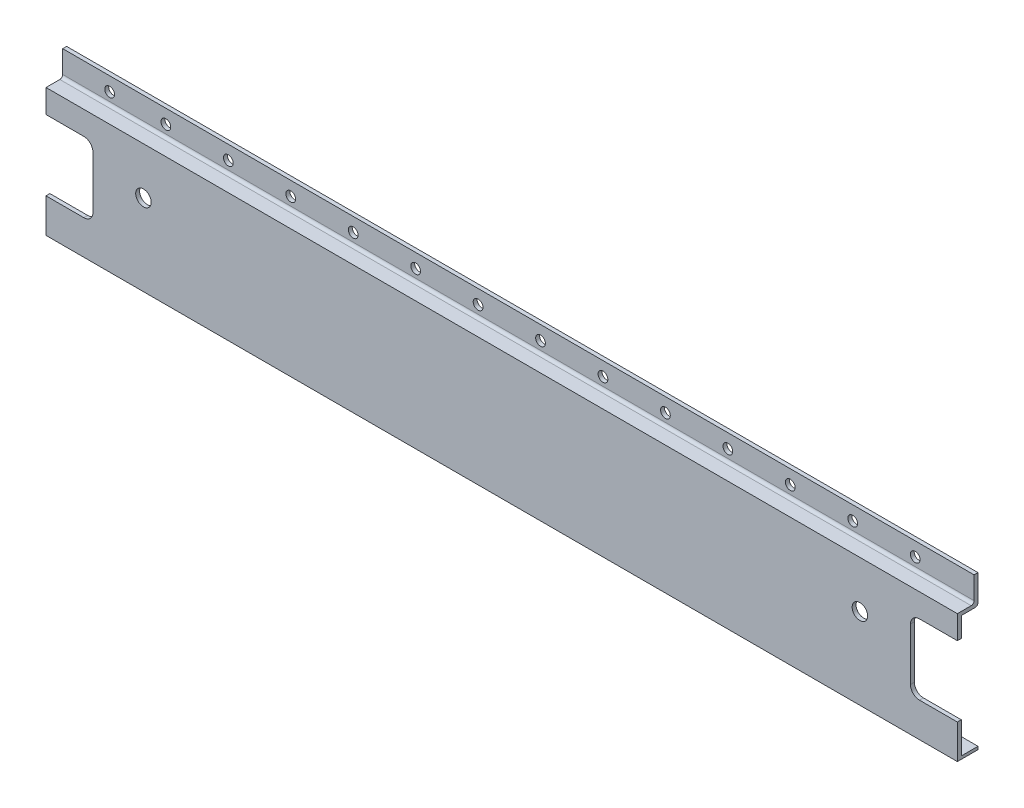
from build123d import *

# Parameters (mm, degrees)
SKETCH1_W           = 641.35
SKETCH1_H           = 107.95
BOSS_EXTRUDE1_DEPTH = 14.5161
SKETCH2_W           = 641.35
SKETCH2_H           = 17.78
CUT_EXTRUDE1_DEPTH  = 11.7602
SKETCH3_W           = 641.35
SKETCH3_H           = 85.5345
CUT_EXTRUDE3_DEPTH  = 11.7602
FILLET1_R           = 2.032
CUT_EXTRUDE4_DEPTH  = 326.398307546
SKETCH5_R           = 3.429
CUT_EXTRUDE5_DEPTH  = 11.7602
SKETCH6_R           = 5.461
CUT_EXTRUDE6_DEPTH  = 11.7602
SKETCH7_R           = 2.54
CUT_EXTRUDE7_DEPTH  = 2.54


with BuildPart() as part:
    # Sketch1 → Boss-Extrude1 (new body)
    with BuildSketch(Plane.XY):
        Rectangle(SKETCH1_W, SKETCH1_H)
    extrude(amount=BOSS_EXTRUDE1_DEPTH)

    # Sketch2 → Cut-Extrude1 (cut)
    with BuildSketch(Plane.XY.offset(14.5161)):
        with Locations((0, 45.085)):
            Rectangle(SKETCH2_W, SKETCH2_H)
    extrude(amount=-CUT_EXTRUDE1_DEPTH, mode=Mode.SUBTRACT)

    # Sketch3 → Cut-Extrude3 (cut)
    with BuildSketch(Plane(origin=(0, 0, 0), x_dir=(-1, 0, 0), z_dir=(0, 0, -1))):
        with Locations((0, -9.11225)):
            Rectangle(SKETCH3_W, SKETCH3_H)
    extrude(amount=-CUT_EXTRUDE3_DEPTH, mode=Mode.SUBTRACT)

    # Fillet1
    fillet1_edges = [part.edges().sort_by_distance(p)[0] for p in [
        (0, 36.195, 2.7559),
        (0, 33.655, 0),
    ]]
    fillet(fillet1_edges, radius=FILLET1_R)

    # Sketch4 → Cut-Extrude4 (cut, through all)
    with BuildSketch(Plane(origin=(0, 0, 11.7602), x_dir=(-1, 0, 0), z_dir=(0, 0, -1))):
        with BuildLine():
            Line((-294.005, 19.685), (-320.675, 19.685))
            Line((-320.675, 19.685), (-320.675, -29.845))
            Line((-320.675, -29.845), (-294.005, -29.845))
            ThreePointArc((-294.005, -29.845), (-289.514871939, -27.985128061), (-287.655, -23.495))
            Line((-287.655, -23.495), (-287.655, 13.335))
            ThreePointArc((-287.655, 13.335), (-289.514871939, 17.825128061), (-294.005, 19.685))
        make_face()
        with BuildLine():
            Line((294.005, -29.845), (320.675, -29.845))
            Line((320.675, -29.845), (320.675, 19.685))
            Line((320.675, 19.685), (294.005, 19.685))
            ThreePointArc((294.005, 19.685), (289.514871939, 17.825128061), (287.655, 13.335))
            Line((287.655, 13.335), (287.655, -23.495))
            ThreePointArc((287.655, -23.495), (289.514871939, -27.985128061), (294.005, -29.845))
        make_face()
    extrude(amount=-CUT_EXTRUDE4_DEPTH, mode=Mode.SUBTRACT)

    # Sketch5 → Cut-Extrude5 (cut)
    with BuildSketch(Plane(origin=(0, 0, 0), x_dir=(-1, 0, 0), z_dir=(0, 0, -1))):
        with Locations((-279.222061941, 44.148206771)):
            Circle(SKETCH5_R)
        with Locations((-235.280061941, 44.148206771)):
            Circle(SKETCH5_R)
        with Locations((-191.338061941, 44.148206771)):
            Circle(SKETCH5_R)
        with Locations((-147.396061941, 44.148206771)):
            Circle(SKETCH5_R)
        with Locations((-103.454061941, 44.148206771)):
            Circle(SKETCH5_R)
        with Locations((-59.512061941, 44.148206771)):
            Circle(SKETCH5_R)
        with Locations((-15.570061941, 44.148206771)):
            Circle(SKETCH5_R)
        with Locations((28.371938059, 44.148206771)):
            Circle(SKETCH5_R)
        with Locations((72.313938059, 44.148206771)):
            Circle(SKETCH5_R)
        with Locations((116.255938059, 44.148206771)):
            Circle(SKETCH5_R)
        with Locations((160.197938059, 44.148206771)):
            Circle(SKETCH5_R)
        with Locations((204.139938059, 44.148206771)):
            Circle(SKETCH5_R)
        with Locations((248.081938059, 44.148206771)):
            Circle(SKETCH5_R)
        with Locations((287.655, 44.148206771)):
            Circle(SKETCH5_R)
    extrude(amount=-CUT_EXTRUDE5_DEPTH, mode=Mode.SUBTRACT)

    # Sketch6 → Cut-Extrude6 (cut)
    with BuildSketch(Plane(origin=(0, 0, 11.7602), x_dir=(-1, 0, 0), z_dir=(0, 0, -1))):
        with Locations((-252.095, 3.175)):
            Circle(SKETCH6_R)
        with Locations((252.095, 3.175)):
            Circle(SKETCH6_R)
    extrude(amount=-CUT_EXTRUDE6_DEPTH, mode=Mode.SUBTRACT)

    # Sketch7 → Cut-Extrude7 (cut)
    with BuildSketch(Plane(origin=(0, -51.8795, 0), x_dir=(1, 0, 0), z_dir=(0, 1, 0))):
        with Locations(Location((-206.375, -5.8801, 0), (0, 0, 180))):
            Circle(SKETCH7_R)
        with Locations(Location((-197.485, -5.8801, 0), (0, 0, 180))):
            Circle(SKETCH7_R)
        with Locations(Location((-188.595, -5.8801, 0), (0, 0, 180))):
            Circle(SKETCH7_R)
        with Locations(Location((197.485, -5.8801, 0), (0, 0, 270))):
            Circle(SKETCH7_R)
        with Locations(Location((188.595, -5.8801, 0), (0, 0, 270))):
            Circle(SKETCH7_R)
        with Locations(Location((206.375, -5.8801, 0), (0, 0, 270))):
            Circle(SKETCH7_R)
    extrude(amount=-CUT_EXTRUDE7_DEPTH, mode=Mode.SUBTRACT)


solid = part.part
